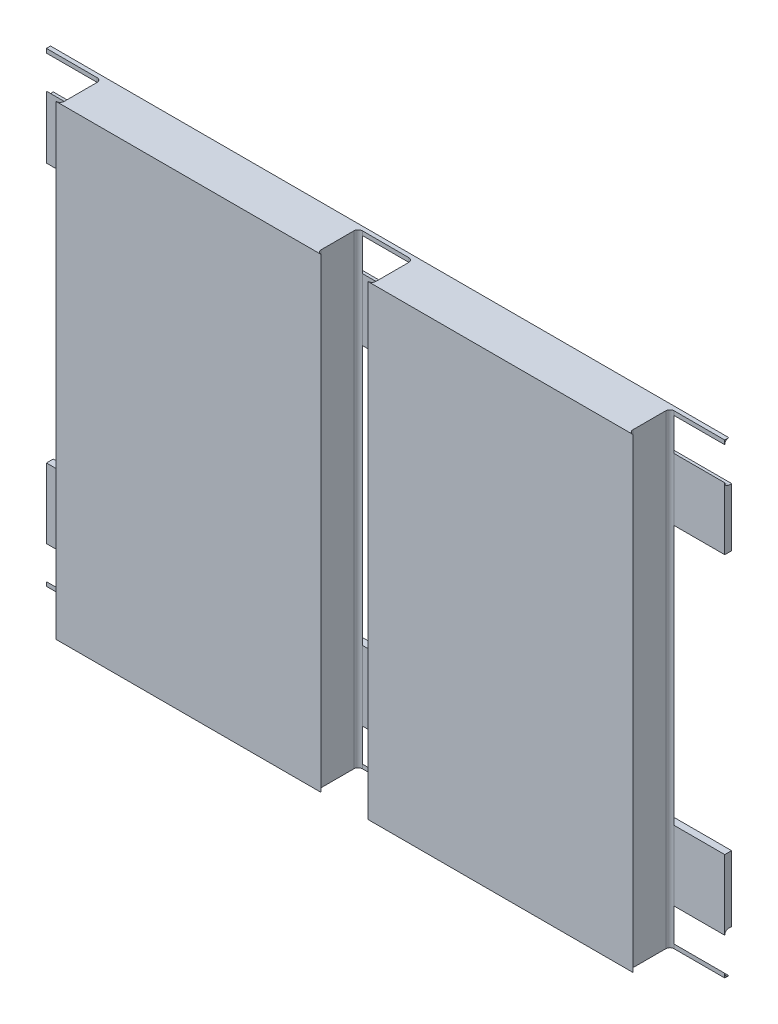
from build123d import *

# Parameters (mm, degrees)
SKETCH1_W           = 990
SKETCH1_H           = 680
BOSS_EXTRUDE1_DEPTH = 70
SKETCH2_W           = 990
SKETCH2_H           = 379
CUT_EXTRUDE1_DEPTH  = 10
CUT_EXTRUDE2_DEPTH  = 1204.079382252
CUT_EXTRUDE4_DEPTH  = 844.993483387


with BuildPart() as part:
    # Sketch1 → Boss-Extrude1 (new body)
    with BuildSketch(Plane.XY):
        with Locations((0, -340)):
            Rectangle(SKETCH1_W, SKETCH1_H)
    extrude(amount=-BOSS_EXTRUDE1_DEPTH)

    # Sketch2 → Cut-Extrude1 (cut)
    with BuildSketch(Plane(origin=(0, 0, -70), x_dir=(-1, 0, 0), z_dir=(0, 0, -1))):
        with Locations((0, -334.5)):
            Rectangle(SKETCH2_W, SKETCH2_H)
    extrude(amount=-CUT_EXTRUDE1_DEPTH, mode=Mode.SUBTRACT)

    # Sketch3 → Cut-Extrude2 (cut, through all)
    with BuildSketch(Plane.ZY.offset(495)):
        with BuildLine():
            Line((-134, -680), (-66, -680))
            ThreePointArc((-66, -680), (-61.757359313, -678.242640687), (-60, -674))
            Line((-60, -674), (-60, -626))
            ThreePointArc((-60, -626), (-61.757359313, -621.757359313), (-66, -620))
            Line((-66, -620), (-134, -620))
            ThreePointArc((-134, -620), (-138.242640687, -621.757359313), (-140, -626))
            Line((-140, -626), (-140, -674))
            ThreePointArc((-140, -674), (-138.242640687, -678.242640687), (-134, -680))
        make_face()
        with BuildLine():
            Line((-134, -60), (-66, -60))
            ThreePointArc((-66, -60), (-61.757359313, -58.242640687), (-60, -54))
            Line((-60, -54), (-60, -6))
            ThreePointArc((-60, -6), (-61.757359313, -1.757359313), (-66, 0))
            Line((-66, 0), (-134, 0))
            ThreePointArc((-134, 0), (-138.242640687, -1.757359313), (-140, -6))
            Line((-140, -6), (-140, -54))
            ThreePointArc((-140, -54), (-138.242640687, -58.242640687), (-134, -60))
        make_face()
    extrude(amount=-CUT_EXTRUDE2_DEPTH, mode=Mode.SUBTRACT)

    # Sketch5 → Cut-Extrude4 (cut, through all)
    with BuildSketch(Plane.XZ.offset(680)):
        with BuildLine():
            ThreePointArc((495, -6), (493.242640687, -1.757359313), (489, 0))
            Line((489, 0), (489, -60))
            ThreePointArc((489, -60), (493.242640687, -58.242640687), (495, -54))
            Line((495, -54), (495, -6))
        make_face()
        with BuildLine():
            Line((489, 0), (421, 0))
            ThreePointArc((421, 0), (416.757359313, -1.757359313), (415, -6))
            Line((415, -6), (415, -54))
            ThreePointArc((415, -54), (416.757359313, -58.242640687), (421, -60))
            Line((421, -60), (489, -60))
            Line((489, -60), (489, 0))
        make_face()
        with BuildLine():
            Line((34, 0), (-34, 0))
            ThreePointArc((-34, 0), (-38.242640687, -1.757359313), (-40, -6))
            Line((-40, -6), (-40, -54))
            ThreePointArc((-40, -54), (-38.242640687, -58.242640687), (-34, -60))
            Line((-34, -60), (34, -60))
            ThreePointArc((34, -60), (38.242640687, -58.242640687), (40, -54))
            Line((40, -54), (40, -6))
            ThreePointArc((40, -6), (38.242640687, -1.757359313), (34, 0))
        make_face()
        with BuildLine():
            Line((-489, 0), (-489, -60))
            Line((-489, -60), (-421, -60))
            ThreePointArc((-421, -60), (-416.757359313, -58.242640687), (-415, -54))
            Line((-415, -54), (-415, -6))
            ThreePointArc((-415, -6), (-416.757359313, -1.757359313), (-421, 0))
            Line((-421, 0), (-489, 0))
        make_face()
        with BuildLine():
            ThreePointArc((-495, -54), (-493.242640687, -58.242640687), (-489, -60))
            Line((-489, -60), (-489, 0))
            ThreePointArc((-489, 0), (-493.242640687, -1.757359313), (-495, -6))
            Line((-495, -6), (-495, -54))
        make_face()
        with BuildLine():
            Line((-495, -60), (-489, -60))
            ThreePointArc((-489, -60), (-493.242640687, -58.242640687), (-495, -54))
            Line((-495, -54), (-495, -60))
        make_face()
        with BuildLine():
            ThreePointArc((-495, -6), (-493.242640687, -1.757359313), (-489, 0))
            Line((-489, 0), (-495, 0))
            Line((-495, 0), (-495, -6))
        make_face()
        with BuildLine():
            Line((495, 0), (489, 0))
            ThreePointArc((489, 0), (493.242640687, -1.757359313), (495, -6))
            Line((495, -6), (495, 0))
        make_face()
        with BuildLine():
            ThreePointArc((495, -54), (493.242640687, -58.242640687), (489, -60))
            Line((489, -60), (495, -60))
            Line((495, -60), (495, -54))
        make_face()
    extrude(amount=-CUT_EXTRUDE4_DEPTH, mode=Mode.SUBTRACT)


solid = part.part
